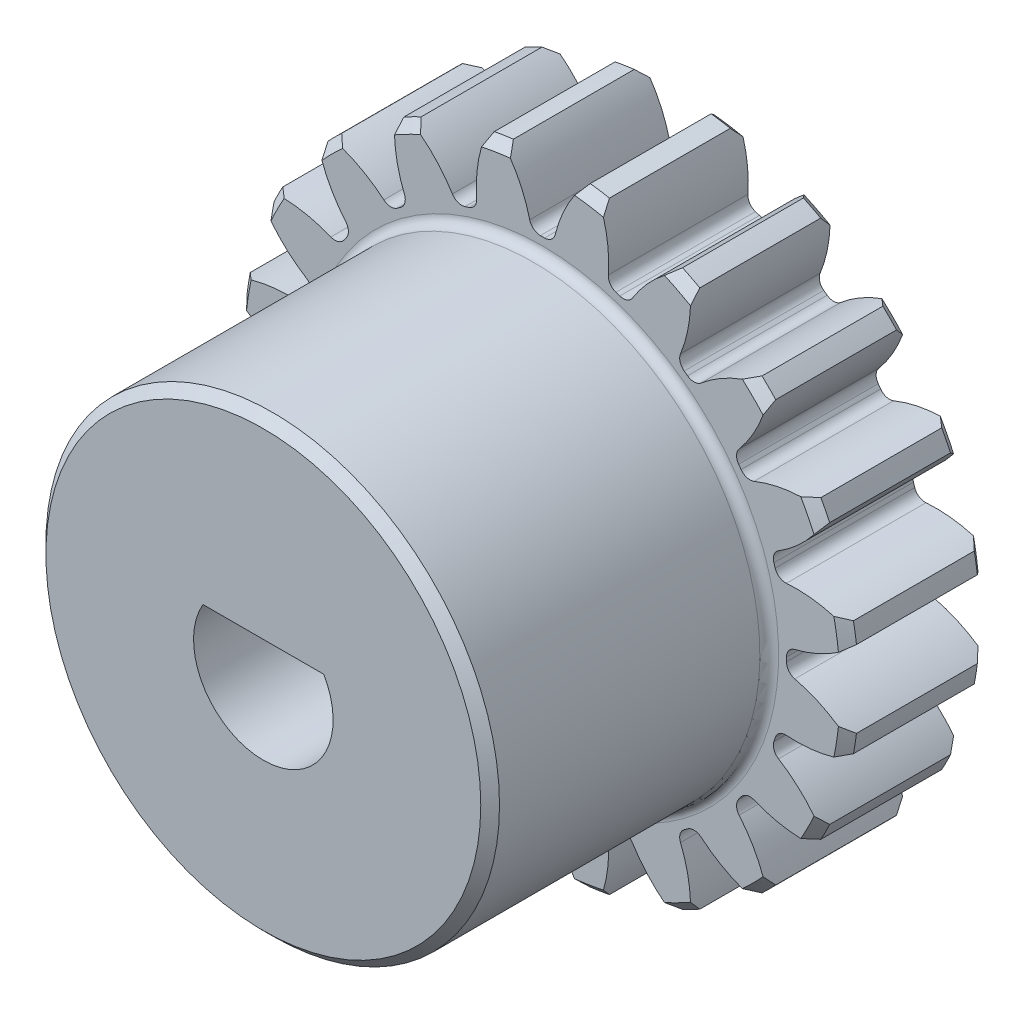
from build123d import *

# Parameters (mm, degrees)
BOSS_EXTRUDE1_DEPTH      = 8
BOSS_EXTRUDE1_DEPTH_BACK = 4
SKETCH3_R                = 8.8
SKETCH5_W                = 8
SKETCH5_H                = 2.3
SKETCH5_W_2              = 12
SKETCH5_H_2              = 2.5
FILLET2_R                = 0.268404029
CHAMFER1_SIZE            = 0.268404029
CUT_EXTRUDE1_DEPTH       = 15.794593607
FILLET1_R                = 0.314159265
CIRPATTERN1_COUNT        = 20
FILLET1_OF_CIRPATTERN1_R = 0.314159265
SKETCH6_R                = 4.069514099
BOSS_EXTRUDE2_DEPTH      = 12


with BuildPart() as part:
    # Sketch3 → Boss-Extrude1 (new, two sides: drawn at the far end of the back side and taken through both)
    with BuildSketch(Plane.XY.offset(-BOSS_EXTRUDE1_DEPTH_BACK)):
        Circle(SKETCH3_R)
    extrude(amount=BOSS_EXTRUDE1_DEPTH + BOSS_EXTRUDE1_DEPTH_BACK)

    # Sketch5 → Cut-Revolve1 (revolve, cut)
    with BuildSketch(Plane(origin=(0, 0, 0), x_dir=(0, 0, -1), z_dir=(1, 0, 0)), mode=Mode.PRIVATE) as cut_revolve1_sk:
        with Locations((-4, 7.65)):
            Rectangle(SKETCH5_W, SKETCH5_H)
        with Locations((-2, 1.25)):
            Rectangle(SKETCH5_W_2, SKETCH5_H_2)
    revolve(cut_revolve1_sk.sketch.rotate(Axis((0, 0, 8), (0, 0, -1)), 180), axis=Axis((0, 0, 8), (0, 0, -1)), mode=Mode.SUBTRACT)

    # Fillet2
    fillet2_edges = [part.edges().sort_by_distance(p)[0] for p in [
        (0, 6.5, 0),
    ]]
    fillet(fillet2_edges, radius=FILLET2_R)

    # Chamfer1
    chamfer1_edges = [part.edges().sort_by_distance(p)[0] for p in [
        (0, 2.5, 8),
        (0, 2.5, -4),
        (-8.8, 0, 0),
        (0, 6.5, 8),
        (-8.8, 0, -4),
    ]]
    chamfer(chamfer1_edges, length=CHAMFER1_SIZE)

    # Sketch4 → Cut-Extrude1 (cut, symmetric)
    with BuildSketch(Plane.XY):
        with BuildLine():
            Line((6.992946729, 0.314159265), (6.992946729, -0.314159265))
            ThreePointArc((6.992946729, -0.314159265), (7.91069249, -0.600039629), (8.730796223, -1.101452363))
            ThreePointArc((8.730796223, -1.101452363), (8.8, 0), (8.730796223, 1.101452363))
            ThreePointArc((8.730796223, 1.101452363), (7.91069249, 0.600039629), (6.992946729, 0.314159265))
        make_face()
    cut_extrude1 = extrude(amount=CUT_EXTRUDE1_DEPTH, both=True, mode=Mode.SUBTRACT)

    # Fillet1
    fillet1_edges = [part.edges().sort_by_distance(p)[0] for p in [
        (6.992946729, 0.314159265, -2),
        (6.992946729, -0.314159265, -2),
    ]]
    fillet(fillet1_edges, radius=FILLET1_R)

    # CirPattern1: Cut-Extrude1 ×20 about axis
    cirpattern1_axis = Axis((0, 0, 0), (0, 0, 1))
    for i in range(1, CIRPATTERN1_COUNT):
        add(cut_extrude1.rotate(cirpattern1_axis, i * 360 / CIRPATTERN1_COUNT), mode=Mode.SUBTRACT)

    # Fillet1 of CirPattern1
    fillet1_of_cirpattern1_edges = [part.edges().sort_by_distance(p)[0] for p in [
        (6.553607003, 2.459722597, -2),
        (6.747768107, 1.862156164, -2),
        (5.472754562, 4.364511142, -2),
        (5.842070928, 3.856190773, -2),
        (3.856190773, 5.842070928, -2),
        (4.364511142, 5.472754562, -2),
        (1.862156164, 6.747768107, -2),
        (2.459722597, 6.553607003, -2),
        (-0.314159265, 6.992946729, -2),
        (0.314159265, 6.992946729, -2),
        (-2.459722597, 6.553607003, -2),
        (-1.862156164, 6.747768107, -2),
        (-4.364511142, 5.472754562, -2),
        (-3.856190773, 5.842070928, -2),
        (-5.842070928, 3.856190773, -2),
        (-5.472754562, 4.364511142, -2),
        (-6.747768107, 1.862156164, -2),
        (-6.553607003, 2.459722597, -2),
        (-6.992946729, -0.314159265, -2),
        (-6.992946729, 0.314159265, -2),
        (-6.553607003, -2.459722597, -2),
        (-6.747768107, -1.862156164, -2),
        (-5.472754562, -4.364511142, -2),
        (-5.842070928, -3.856190773, -2),
        (-3.856190773, -5.842070928, -2),
        (-4.364511142, -5.472754562, -2),
        (-1.862156164, -6.747768107, -2),
        (-2.459722597, -6.553607003, -2),
        (0.314159265, -6.992946729, -2),
        (-0.314159265, -6.992946729, -2),
        (2.459722597, -6.553607003, -2),
        (1.862156164, -6.747768107, -2),
        (4.364511142, -5.472754562, -2),
        (3.856190773, -5.842070928, -2),
        (5.842070928, -3.856190773, -2),
        (5.472754562, -4.364511142, -2),
        (6.747768107, -1.862156164, -2),
        (6.553607003, -2.459722597, -2),
    ]]
    fillet(fillet1_of_cirpattern1_edges, radius=FILLET1_OF_CIRPATTERN1_R)

    # Sketch6 → Boss-Extrude2 (add, through all)
    with BuildSketch(Plane.XY.offset(8)):
        Circle(SKETCH6_R)
        with BuildLine():
            Line((-1.732050808, 1), (1.732050808, 1))
            ThreePointArc((1.732050808, 1), (0, -2), (-1.732050808, 1))
        make_face(mode=Mode.SUBTRACT)
    extrude(amount=-BOSS_EXTRUDE2_DEPTH)


solid = part.part
